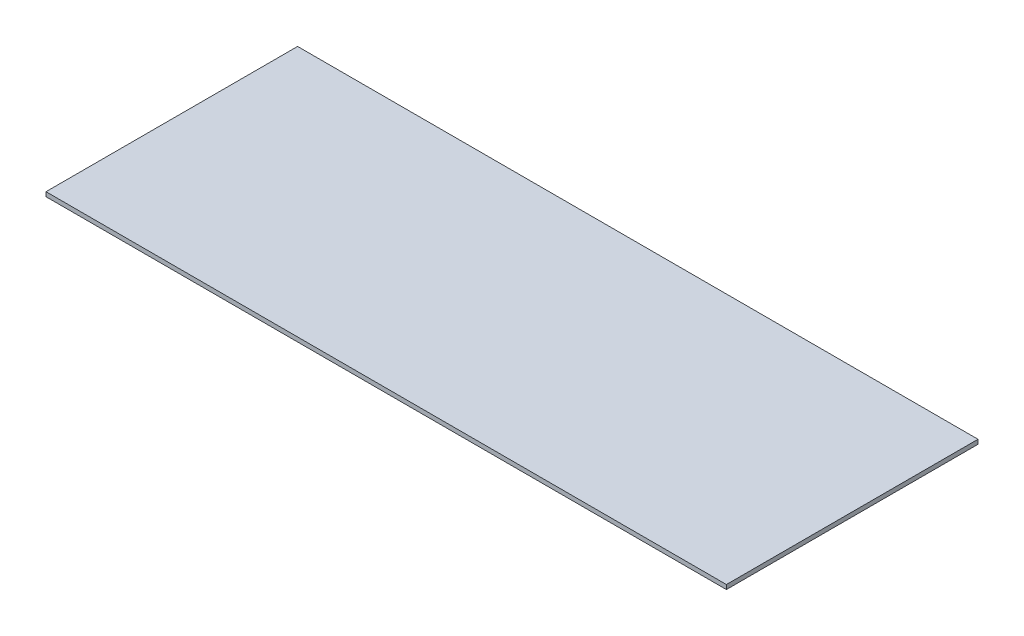
from build123d import *

# Parameters (mm, degrees)
SKETCH1_W           = 311
SKETCH1_H           = 115
BOSS_EXTRUDE1_DEPTH = 2


with BuildPart() as part:
    # Sketch1 → Boss-Extrude1 (new body)
    with BuildSketch(Plane(origin=(0, 0, 0), x_dir=(1, 0, 0), z_dir=(0, 1, 0))):
        with Locations((155.5, 57.5)):
            Rectangle(SKETCH1_W, SKETCH1_H)
    extrude(amount=BOSS_EXTRUDE1_DEPTH)


solid = part.part
